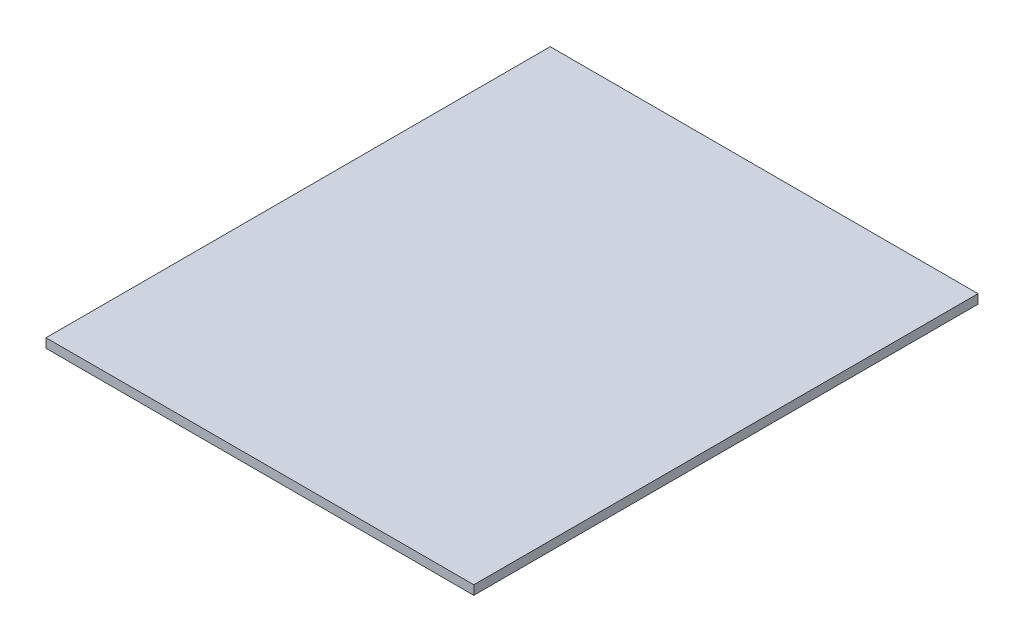
from build123d import *

# Parameters (mm, degrees)
SKETCH1_W           = 140
SKETCH1_H           = 165
BOSS_EXTRUDE1_DEPTH = 3


with BuildPart() as part:
    # Sketch1 → Boss-Extrude1 (new body)
    with BuildSketch(Plane(origin=(0, 0, 0), x_dir=(1, 0, 0), z_dir=(0, 1, 0))):
        Rectangle(SKETCH1_W, SKETCH1_H)
    extrude(amount=BOSS_EXTRUDE1_DEPTH)


solid = part.part
